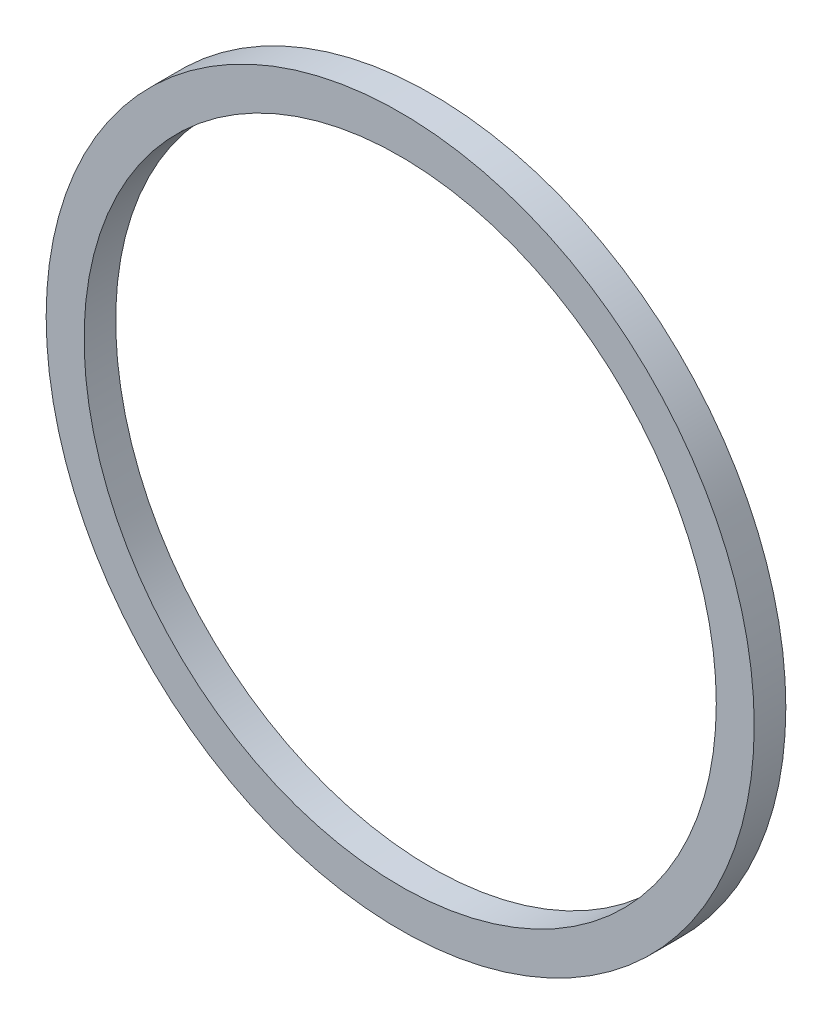
from build123d import *

# Parameters (mm, degrees)
SKETCH_1_R      = 11.2
SKETCH_1_R_2    = 10
EXTRUDE_1_DEPTH = 1


with BuildPart() as part:
    # 草图1 → 凸台-拉伸1 (new body)
    with BuildSketch(Plane.XY):
        Circle(SKETCH_1_R)
        Circle(SKETCH_1_R_2, mode=Mode.SUBTRACT)
    extrude(amount=EXTRUDE_1_DEPTH)


solid = part.part
